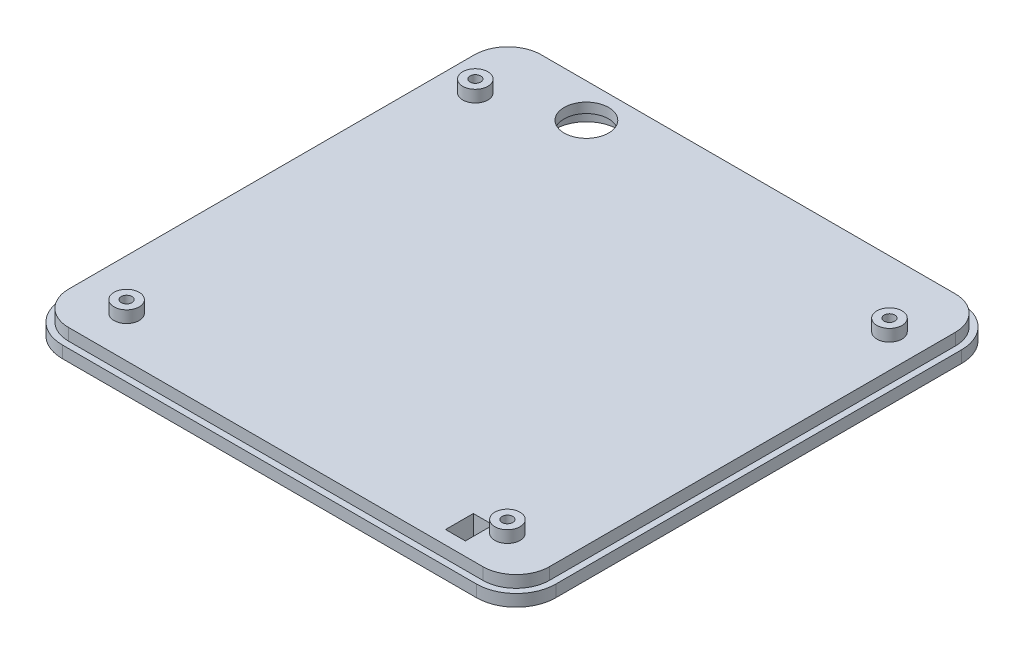
from build123d import *

# Parameters (mm, degrees)
SKETCH1_R           = 1.35
BOSS_EXTRUDE1_DEPTH = 6
SKETCH2_R           = 2.5
SKETCH2_R_2         = 1.35
CUT_EXTRUDE1_DEPTH  = 3
SKETCH3_R           = 3.175
SKETCH3_R_2         = 1.35
BOSS_EXTRUDE2_DEPTH = 3
CUT_EXTRUDE2_START  = -3
CUT_EXTRUDE2_DEPTH  = 3
SKETCH7_R           = 5.6
CUT_EXTRUDE3_DEPTH  = 10
CUT_EXTRUDE4_START  = -3.5
SKETCH8_R           = 8
SKETCH8_R_2         = 5.6
CUT_EXTRUDE4_DEPTH  = 3.5
SKETCH9_W           = 5
SKETCH9_H           = 7
CUT_EXTRUDE5_DEPTH  = 92.268613627


with BuildPart() as part:
    # Sketch1 → Boss-Extrude1 (new body)
    with BuildSketch(Plane(origin=(0, 0, 0), x_dir=(1, 0, 0), z_dir=(0, 1, 0))):
        with BuildLine():
            Line((-52.2, 66.182473763), (52.2, 66.182473763))
            ThreePointArc((52.2, 66.182473763), (59.271067812, 63.253541574), (62.2, 56.182473763))
            Line((62.2, 56.182473763), (62.2, -46.121814954))
            ThreePointArc((62.2, -46.121814954), (59.271067812, -53.192882766), (52.2, -56.121814954))
            Line((52.2, -56.121814954), (-52.2, -56.121814954))
            ThreePointArc((-52.2, -56.121814954), (-59.271067812, -53.192882766), (-62.2, -46.121814954))
            Line((-62.2, -46.121814954), (-62.2, 56.182473763))
            ThreePointArc((-62.2, 56.182473763), (-59.271067812, 63.253541574), (-52.2, 66.182473763))
        make_face()
        with Locations(Location((-48, -44.121814954, 0), (0, 0, 270))):
            Circle(SKETCH1_R, mode=Mode.SUBTRACT)
        with Locations(Location((-52.2, 47.982473763, 0), (0, 0, 270))):
            Circle(SKETCH1_R, mode=Mode.SUBTRACT)
        with Locations(Location((52.2, 47.982473763, 0), (0, 0, 270))):
            Circle(SKETCH1_R, mode=Mode.SUBTRACT)
        with Locations(Location((48, -44.121814954, 0), (0, 0, 270))):
            Circle(SKETCH1_R, mode=Mode.SUBTRACT)
    extrude(amount=BOSS_EXTRUDE1_DEPTH)

    # Sketch2 → Cut-Extrude1 (cut)
    # profile 1 of 4: a face of its own
    with BuildSketch(Plane.XZ):
        with Locations(Location((-48, 44.121814954, 0), (0, 0, 270))):
            Circle(SKETCH2_R)
        with Locations(Location((-48, 44.121814954, 0), (0, 0, 270))):
            Circle(SKETCH2_R_2, mode=Mode.SUBTRACT)
    # profile 2 of 4: a face of its own
    with BuildSketch(Plane.XZ):
        with Locations(Location((-52.2, -47.982473763, 0), (0, 0, 270))):
            Circle(SKETCH2_R)
        with Locations(Location((-52.2, -47.982473763, 0), (0, 0, 270))):
            Circle(SKETCH2_R_2, mode=Mode.SUBTRACT)
    # profile 3 of 4: a face of its own
    with BuildSketch(Plane.XZ):
        with Locations(Location((52.2, -47.982473763, 0), (0, 0, 270))):
            Circle(SKETCH2_R)
        with Locations(Location((52.2, -47.982473763, 0), (0, 0, 270))):
            Circle(SKETCH2_R_2, mode=Mode.SUBTRACT)
    # profile 4 of 4: a face of its own
    with BuildSketch(Plane.XZ):
        with Locations(Location((48, 44.121814954, 0), (0, 0, 270))):
            Circle(SKETCH2_R)
        with Locations(Location((48, 44.121814954, 0), (0, 0, 270))):
            Circle(SKETCH2_R_2, mode=Mode.SUBTRACT)
    extrude(amount=-CUT_EXTRUDE1_DEPTH, mode=Mode.SUBTRACT)

    # Sketch3 → Boss-Extrude2 (add)
    # profile 1 of 4: a face of its own
    with BuildSketch(Plane(origin=(0, 6, 0), x_dir=(1, 0, 0), z_dir=(0, 1, 0))):
        with Locations(Location((-52.2, 47.982473763, 0), (0, 0, 270))):
            Circle(SKETCH3_R)
        with Locations(Location((-52.2, 47.982473763, 0), (0, 0, 90))):
            Circle(SKETCH3_R_2, mode=Mode.SUBTRACT)
    # profile 2 of 4: a face of its own
    with BuildSketch(Plane(origin=(0, 6, 0), x_dir=(1, 0, 0), z_dir=(0, 1, 0))):
        with Locations(Location((52.2, 47.982473763, 0), (0, 0, 270))):
            Circle(SKETCH3_R)
        with Locations(Location((52.2, 47.982473763, 0), (0, 0, 90))):
            Circle(SKETCH3_R_2, mode=Mode.SUBTRACT)
    # profile 3 of 4: a face of its own
    with BuildSketch(Plane(origin=(0, 6, 0), x_dir=(1, 0, 0), z_dir=(0, 1, 0))):
        with Locations(Location((48, -44.121814954, 0), (0, 0, 270))):
            Circle(SKETCH3_R)
        with Locations(Location((48, -44.121814954, 0), (0, 0, 90))):
            Circle(SKETCH3_R_2, mode=Mode.SUBTRACT)
    # profile 4 of 4: a face of its own
    with BuildSketch(Plane(origin=(0, 6, 0), x_dir=(1, 0, 0), z_dir=(0, 1, 0))):
        with Locations(Location((-48, -44.121814954, 0), (0, 0, 270))):
            Circle(SKETCH3_R)
        with Locations(Location((-48, -44.121814954, 0), (0, 0, 90))):
            Circle(SKETCH3_R_2, mode=Mode.SUBTRACT)
    extrude(amount=BOSS_EXTRUDE2_DEPTH)

    # Sketch4 → Cut-Extrude2 (cut)
    with BuildSketch(Plane(origin=(0, 6, 0), x_dir=(1, 0, 0), z_dir=(0, 1, 0)).offset(CUT_EXTRUDE2_START)):
        with BuildLine():
            Line((52.2, 66.182473763), (-52.2, 66.182473763))
            ThreePointArc((-52.2, 66.182473763), (-59.271067812, 63.253541574), (-62.2, 56.182473763))
            Line((-62.2, 56.182473763), (-62.2, -46.121814954))
            ThreePointArc((-62.2, -46.121814954), (-59.271067812, -53.192882766), (-52.2, -56.121814954))
            Line((-52.2, -56.121814954), (52.2, -56.121814954))
            ThreePointArc((52.2, -56.121814954), (59.271067812, -53.192882766), (62.2, -46.121814954))
            Line((62.2, -46.121814954), (62.2, 56.182473763))
            ThreePointArc((62.2, 56.182473763), (59.271067812, 63.253541574), (52.2, 66.182473763))
        make_face()
        with BuildLine():
            Line((-60.6, 56.182473763), (-60.6, -46.121814954))
            ThreePointArc((-60.6, -46.121814954), (-58.139696962, -52.061511916), (-52.2, -54.521814954))
            Line((-52.2, -54.521814954), (52.2, -54.521814954))
            ThreePointArc((52.2, -54.521814954), (58.139696962, -52.061511916), (60.6, -46.121814954))
            Line((60.6, -46.121814954), (60.6, 56.182473763))
            ThreePointArc((60.6, 56.182473763), (58.139696962, 62.122170725), (52.2, 64.582473763))
            Line((52.2, 64.582473763), (-52.2, 64.582473763))
            ThreePointArc((-52.2, 64.582473763), (-58.139696962, 62.122170725), (-60.6, 56.182473763))
        make_face(mode=Mode.SUBTRACT)
    extrude(amount=CUT_EXTRUDE2_DEPTH, mode=Mode.SUBTRACT)

    # Sketch7 → Cut-Extrude3 (cut)
    with BuildSketch(Plane(origin=(0, 6, 0), x_dir=(1, 0, 0), z_dir=(0, 1, 0))):
        with Locations(Location((-32.2, 55.982473763, 0), (0, 0, 270))):
            Circle(SKETCH7_R)
    extrude(amount=-CUT_EXTRUDE3_DEPTH, mode=Mode.SUBTRACT)

    # Sketch8 → Cut-Extrude4 (cut)
    with BuildSketch(Plane.XZ.offset(CUT_EXTRUDE4_START)):
        with Locations(Location((-32.2, -55.982473763, 0), (0, 0, 270))):
            Circle(SKETCH8_R)
        with Locations(Location((-32.2, -55.982473763, 0), (0, 0, 90))):
            Circle(SKETCH8_R_2, mode=Mode.SUBTRACT)
    extrude(amount=CUT_EXTRUDE4_DEPTH, mode=Mode.SUBTRACT)

    # Sketch9 → Cut-Extrude5 (cut, through all)
    with BuildSketch(Plane.XZ):
        with Locations((41.9, 47.621814954)):
            Rectangle(SKETCH9_W, SKETCH9_H)
    extrude(amount=-CUT_EXTRUDE5_DEPTH, mode=Mode.SUBTRACT)


solid = part.part
